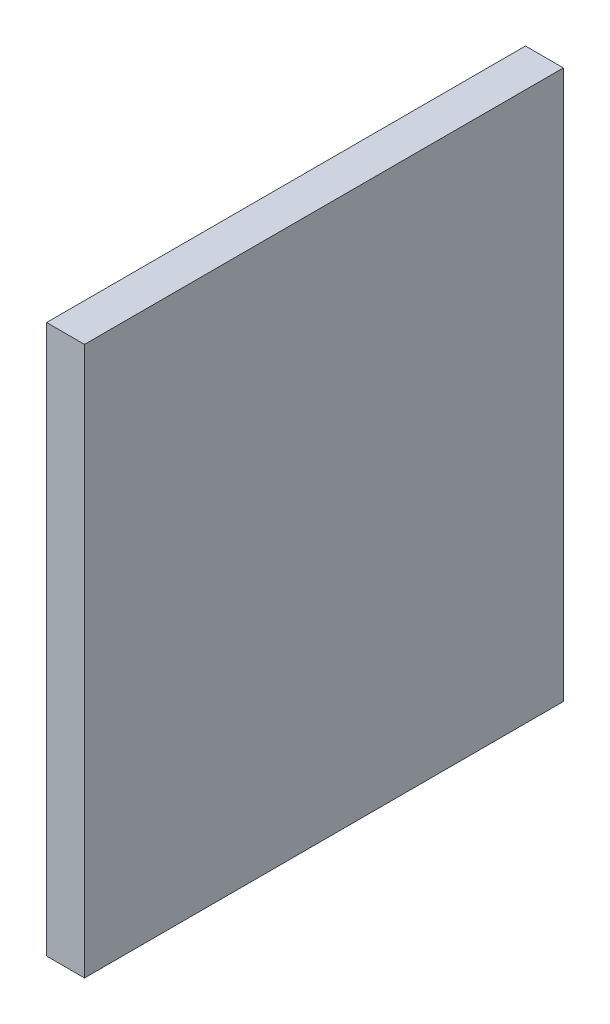
from build123d import *

# Parameters (mm, degrees)
SKETCH_1_W      = 48
SKETCH_1_H      = 55
EXTRUDE_1_DEPTH = 3.8


with BuildPart() as part:
    # 草图1 → 凸台-拉伸1 (new body)
    with BuildSketch(Plane(origin=(0, 0, 0), x_dir=(0, 0, -1), z_dir=(1, 0, 0))):
        with Locations((-32.434782609, -9.1464358)):
            Rectangle(SKETCH_1_W, SKETCH_1_H)
    extrude(amount=EXTRUDE_1_DEPTH)


solid = part.part
